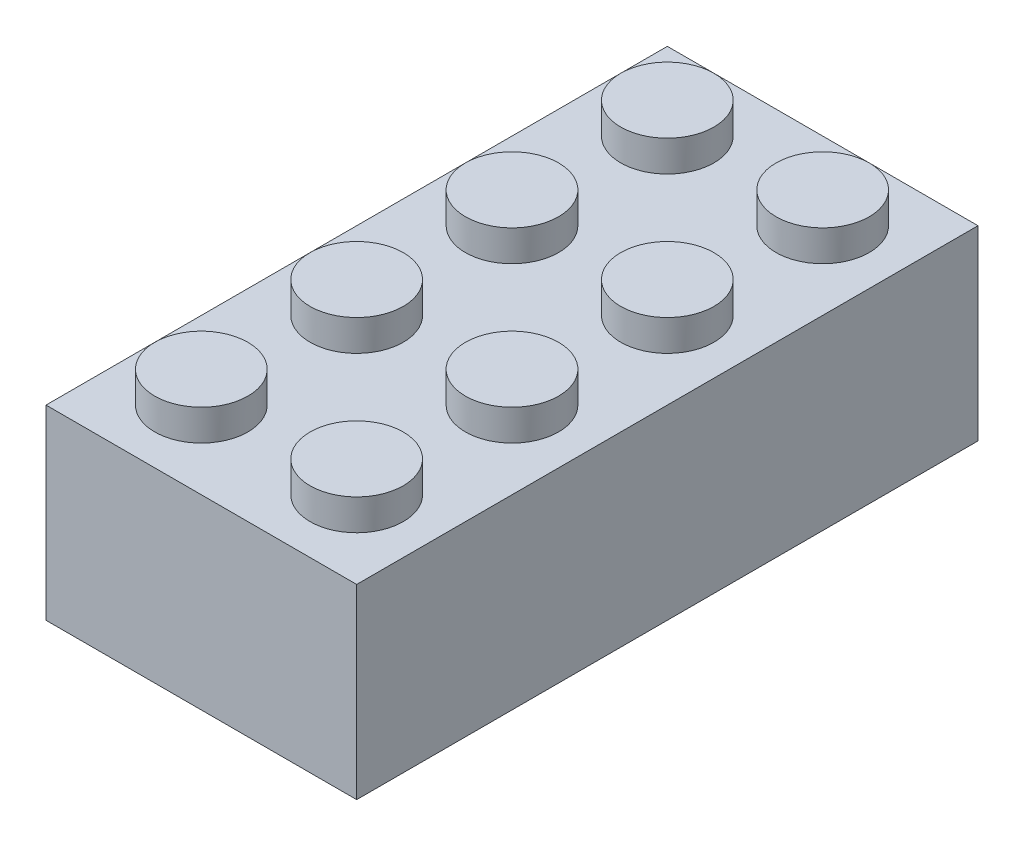
from build123d import *

# Parameters (mm, degrees)
SKETCH1_W            = 16
SKETCH1_H            = 32
BOSS_EXTRUDE1_DEPTH  = 9.6
SKETCH2_R            = 2.4
BOSS_EXTRUDE2_DEPTH  = 1.6
LPATTERN1_COUNT      = 2
LPATTERN1_PITCH      = 8
LPATTERN1_COUNT_DIR2 = 4
LPATTERN1_PITCH_DIR2 = 8
SHELL1_T             = -1.6


with BuildPart() as part:
    # Sketch1 → Boss-Extrude1 (new body)
    with BuildSketch(Plane(origin=(0, 0, 0), x_dir=(1, 0, 0), z_dir=(0, 1, 0))):
        with Locations((8, 16)):
            Rectangle(SKETCH1_W, SKETCH1_H)
    extrude(amount=BOSS_EXTRUDE1_DEPTH)

    # Sketch2 → Boss-Extrude2 (add)
    with BuildSketch(Plane(origin=(0, 9.6, 0), x_dir=(1, 0, 0), z_dir=(0, 1, 0))):
        with Locations(Location((12, 4, 0), (0, 0, 90))):
            Circle(SKETCH2_R)
    boss_extrude2 = extrude(amount=BOSS_EXTRUDE2_DEPTH)

    # LPattern1: Boss-Extrude2 2 × 4
    with Locations(*[(-i * LPATTERN1_PITCH, 0, -j * LPATTERN1_PITCH_DIR2) for i in range(LPATTERN1_COUNT) for j in range(LPATTERN1_COUNT_DIR2) if (i, j) != (0, 0)]):
        add(boss_extrude2)

    # Shell1
    shell1_openings = [part.faces().sort_by_distance(p)[0] for p in [
        (8, 0, -16),
    ]]
    offset(amount=SHELL1_T, openings=shell1_openings, kind=Kind.INTERSECTION)


solid = part.part
